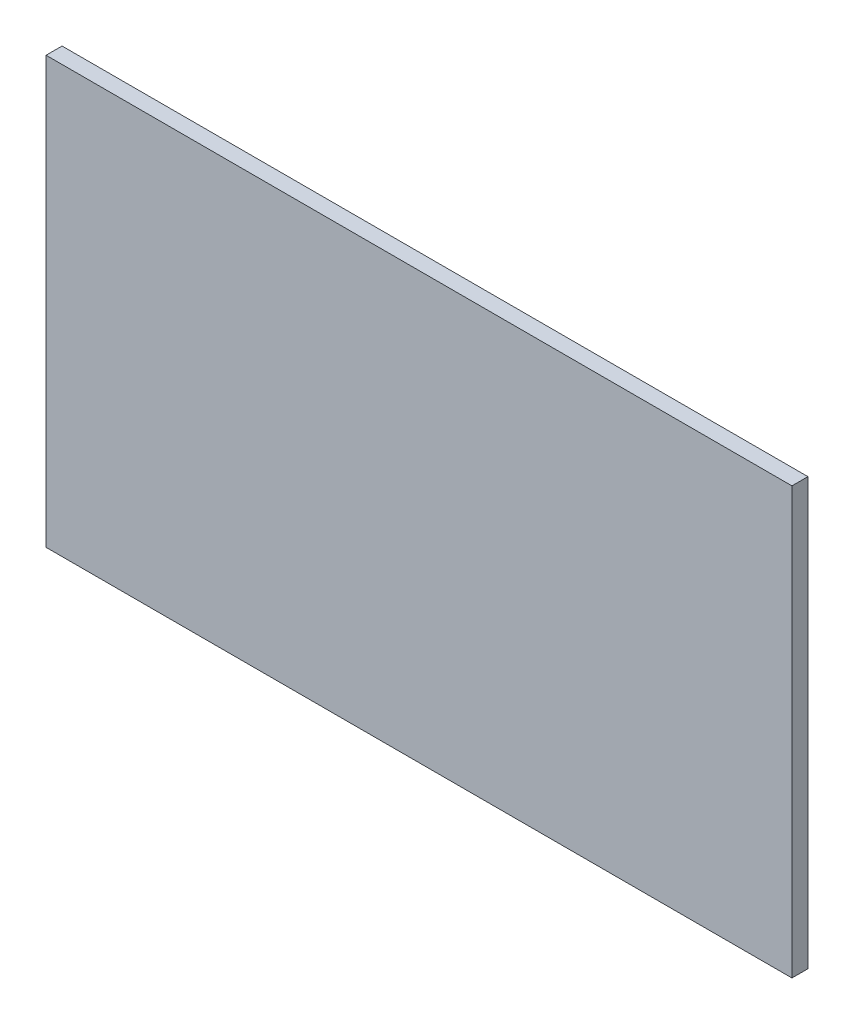
from build123d import *

# Parameters (mm, degrees)
SKETCH1_W           = 140
SKETCH1_H           = 80
BOSS_EXTRUDE1_DEPTH = 3


with BuildPart() as part:
    # Sketch1 → Boss-Extrude1 (new body)
    with BuildSketch(Plane.XY):
        with Locations((70, 40)):
            Rectangle(SKETCH1_W, SKETCH1_H)
    extrude(amount=BOSS_EXTRUDE1_DEPTH)


solid = part.part
